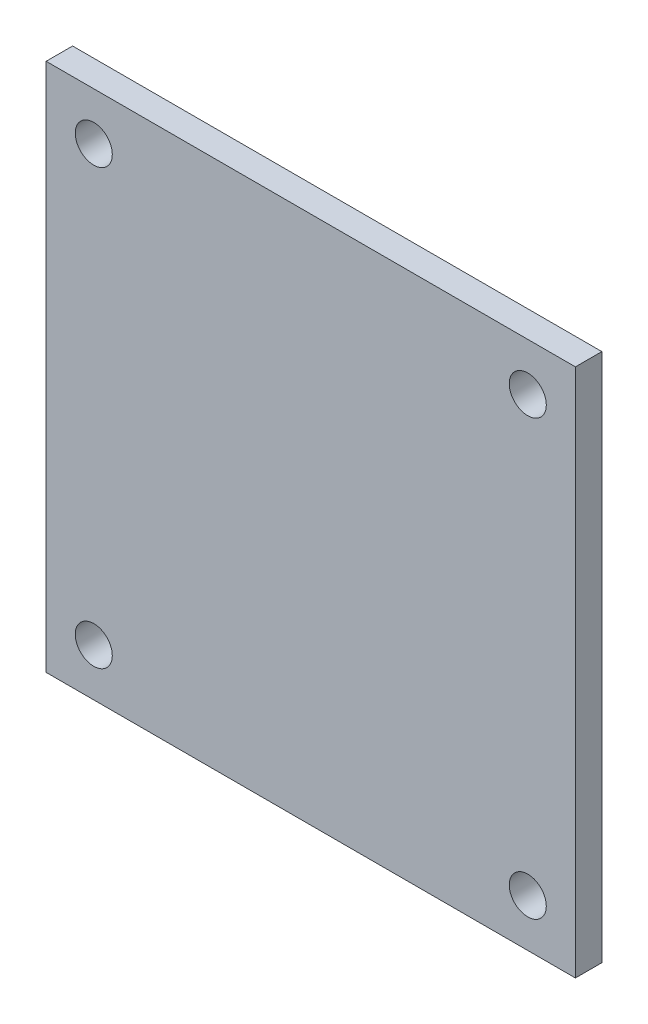
from build123d import *

# Parameters (mm, degrees)
SKETCH_1_W          = 100
SKETCH_1_H          = 100
EXTRUDE_1_DEPTH     = 5
SKETCH_2_R          = 3.5
CUT_EXTRUDE_1_DEPTH = 5


with BuildPart() as part:
    # 草图1 → 凸台-拉伸1 (new body)
    with BuildSketch(Plane.XY):
        Rectangle(SKETCH_1_W, SKETCH_1_H)
    extrude(amount=EXTRUDE_1_DEPTH)

    # 草图2 → 切除-拉伸1 (cut)
    with BuildSketch(Plane.XY.offset(5)):
        with Locations((-41, 41)):
            Circle(SKETCH_2_R)
        with Locations((-41, -41)):
            Circle(SKETCH_2_R)
        with Locations((41, -41)):
            Circle(SKETCH_2_R)
        with Locations((41, 41)):
            Circle(SKETCH_2_R)
    extrude(amount=-CUT_EXTRUDE_1_DEPTH, mode=Mode.SUBTRACT)


solid = part.part
